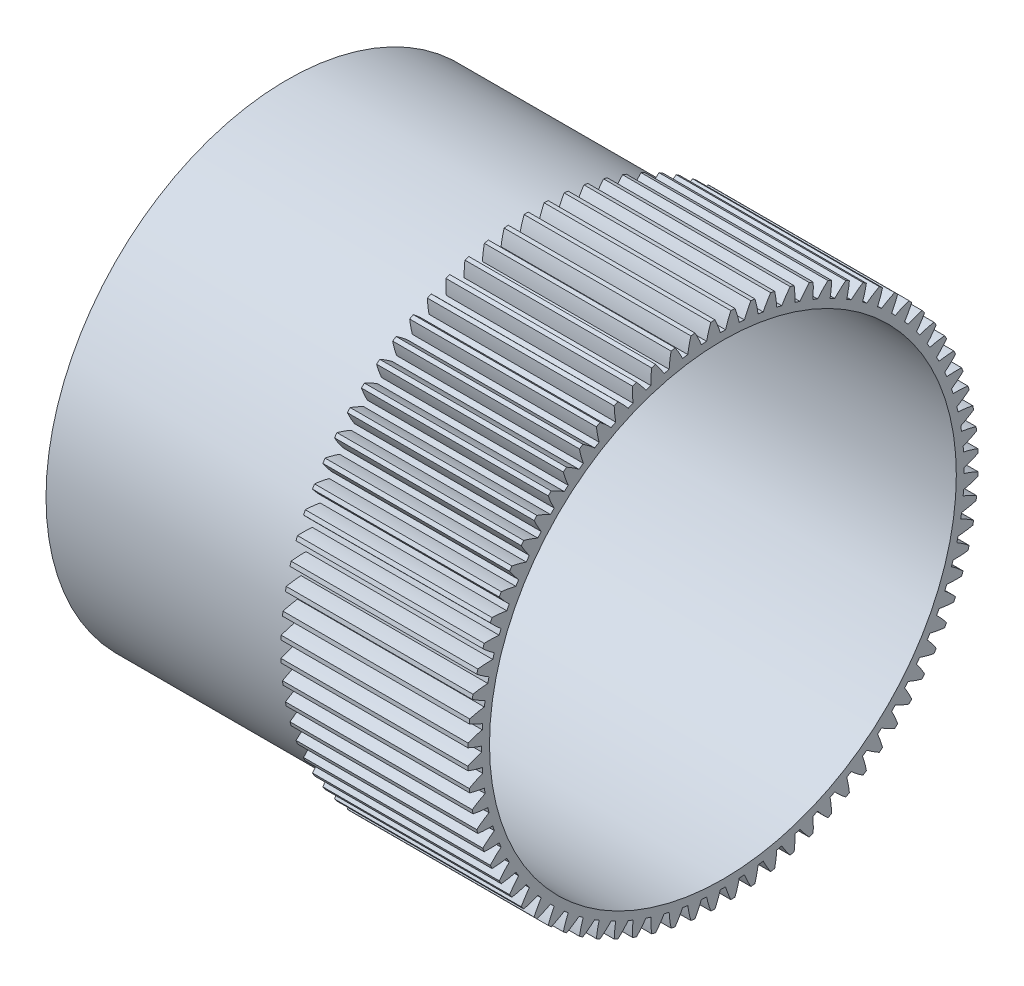
from build123d import *
from build123d.topology import SkipClean

# Parameters (mm, degrees)
BASPROSKE_W         = 15
BASPROSKE_H         = 20.5
TOOTHCUT_DEPTH      = 33.641997488
TEETHCUTS_COUNT     = 80
TEETHCUTS_ANGLE     = 355.5
BORSKE_R            = 0.5
BORE_DEPTH          = 50.001524
SKETCH1_R           = 18.75
CUT_EXTRUDE1_DEPTH  = 33.629446803
BOSS_EXTRUDE5_START = 20
SKETCH4_R           = 19.374
SKETCH4_R_2         = 18.75
BOSS_EXTRUDE5_DEPTH = 20
SKETCH5_R           = 18.75
BOSS_EXTRUDE6_DEPTH = 1
SKETCH6_R           = 2.45
BOSS_EXTRUDE7_DEPTH = 10


with BuildPart() as part:
    # BasProSke → Base-Revolve (revolve)
    with BuildSketch(Plane(origin=(0, 0, 0), x_dir=(1, 0, 0), z_dir=(0, 1, 0)), mode=Mode.PRIVATE) as base_revolve_sk:
        with Locations((7.5, 10.25)):
            Rectangle(BASPROSKE_W, BASPROSKE_H)
    revolve(base_revolve_sk.sketch.rotate(Axis((-10, 0, 0), (1, 0, 0)), 180), axis=Axis((-10, 0, 0), (1, 0, 0)))

    # TooCutSke → ToothCut (cut, through all)
    with BuildSketch(Plane(origin=(0, 0, 0), x_dir=(0, 0, -1), z_dir=(1, 0, 0))):
        with BuildLine():
            ThreePointArc((0.210127665, 19.372860459), (0, 19.374), (-0.210127665, 19.372860459))
            ThreePointArc((-0.210127665, 19.372860459), (-0.409130222, 19.952418525), (-0.651908556, 20.515044733))
            ThreePointArc((-0.651908556, 20.515044733), (0, 20.5254), (0.651908556, 20.515044733))
            ThreePointArc((0.651908556, 20.515044733), (0.409130222, 19.952418525), (0.210127665, 19.372860459))
        make_face()
    toothcut = extrude(amount=TOOTHCUT_DEPTH, mode=Mode.SUBTRACT)

    # TeethCuts: ToothCut ×80 about axis
    teethcuts_axis = Axis((-10, 0, 0), (1, 0, 0))
    for i in range(1, TEETHCUTS_COUNT):
        add(toothcut.rotate(teethcuts_axis, i * TEETHCUTS_ANGLE / (TEETHCUTS_COUNT - 1)), mode=Mode.SUBTRACT)

    # BorSke → Bore (cut, symmetric)
    with BuildSketch(Plane(origin=(0, 0, 0), x_dir=(0, 0, -1), z_dir=(1, 0, 0))):
        with Locations(Location((0, 0, 0), (0, 0, 180))):
            Circle(BORSKE_R)
    extrude(amount=BORE_DEPTH, both=True, mode=Mode.SUBTRACT)

    # Sketch1 → Cut-Extrude1 (cut, through all)
    with BuildSketch(Plane(origin=(15, 0, 0), x_dir=(0, 0, -1), z_dir=(1, 0, 0))):
        Circle(SKETCH1_R)
    extrude(amount=-CUT_EXTRUDE1_DEPTH, mode=Mode.SUBTRACT)

    # Sketch4 → Boss-Extrude5 (add)
    with SkipClean():  # the faces are left unmerged after this step: merging them gives an invalid solid
        with BuildSketch(Plane.ZY.offset(BOSS_EXTRUDE5_START)):
            Circle(SKETCH4_R)
            with Locations(Location((0, 0, 0), (0, 0, 180))):
                Circle(SKETCH4_R_2, mode=Mode.SUBTRACT)
        extrude(amount=-BOSS_EXTRUDE5_DEPTH)

    # Sketch5 → Boss-Extrude6 (add)
    with SkipClean():  # the faces are left unmerged after this step: merging them gives an invalid solid
        with BuildSketch(Plane.ZY.offset(20)):
            with Locations(Location((0, 0, 0), (0, 0, 180))):
                Circle(SKETCH5_R)
        extrude(amount=-BOSS_EXTRUDE6_DEPTH)

    # Sketch6 → Boss-Extrude7 (add)
    with SkipClean():  # the faces are left unmerged after this step: merging them gives an invalid solid
        with BuildSketch(Plane.ZY.offset(20)):
            Circle(SKETCH6_R)
        extrude(amount=BOSS_EXTRUDE7_DEPTH)


solid = part.part
